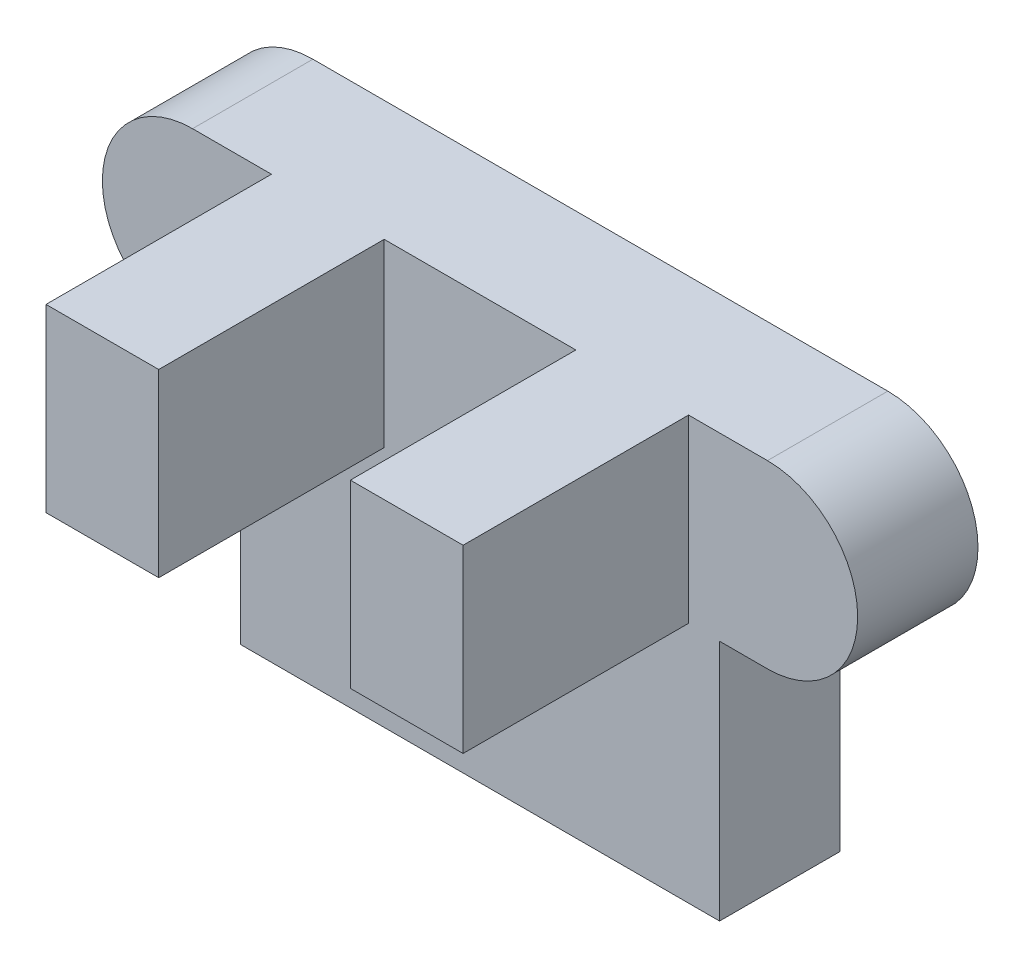
from build123d import *

# Parameters (mm, degrees)
BOSS_EXTRUDE1_DEPTH = 4.27
SKETCH3_W           = 4
SKETCH3_H           = 6.4
BOSS_EXTRUDE2_DEPTH = 8


with BuildPart() as part:
    # Sketch2 → Boss-Extrude1 (new body)
    with BuildSketch(Plane.XY):
        with BuildLine():
            Line((0, 3.2), (20.4, 3.2))
            ThreePointArc((20.4, 3.2), (23.6, 0), (20.4, -3.2))
            Line((20.4, -3.2), (18.7, -3.2))
            Line((18.7, -3.2), (18.7, -11.8))
            Line((18.7, -11.8), (1.7, -11.8))
            Line((1.7, -11.8), (1.7, -3.2))
            Line((1.7, -3.2), (0, -3.2))
            ThreePointArc((0, -3.2), (-3.2, 0), (0, 3.2))
        make_face()
    extrude(amount=BOSS_EXTRUDE1_DEPTH)

    # Sketch3 → Boss-Extrude2 (add)
    with BuildSketch(Plane.XY.offset(4.27)):
        with Locations((4.8, 0)):
            Rectangle(SKETCH3_W, SKETCH3_H)
        with Locations((15.6, 0)):
            Rectangle(SKETCH3_W, SKETCH3_H)
    extrude(amount=BOSS_EXTRUDE2_DEPTH)


solid = part.part
